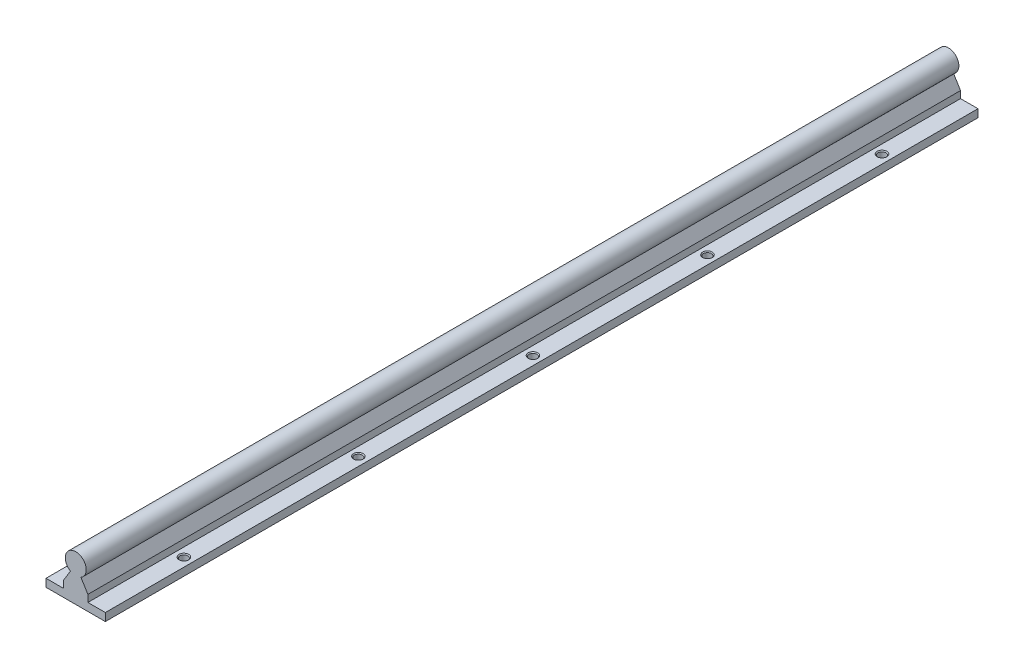
from build123d import *

# Parameters (mm, degrees)
EXTRUSION1_DEPTH                               = 500
FRAISAGE_POUR_VIS_T_TE_FRAIS_E_M41_D           = 4.5
FRAISAGE_POUR_VIS_T_TE_FRAIS_E_M41_CSINK_D     = 5.5
FRAISAGE_POUR_VIS_T_TE_FRAIS_E_M41_CSINK_ANGLE = 90


with BuildPart() as part:
    # Esquisse1 → Extrusion1 (new body)
    with BuildSketch(Plane.XY):
        with BuildLine():
            Line((-38.885451278, -19.821642953), (-4.885451278, -19.821642953))
            Line((-4.885451278, -19.821642953), (-4.885451278, -15.321642953))
            Line((-4.885451278, -15.321642953), (-14.885451278, -15.321642953))
            Line((-14.885451278, -15.321642953), (-14.885451278, -11.321642953))
            Line((-14.885451278, -11.321642953), (-18.885451278, -4.821642953))
            ThreePointArc((-18.885451278, -4.821642953), (-21.78726352, 6.400322803), (-24.885451278, -4.769021956))
            Line((-24.885451278, -4.769021956), (-28.885451278, -11.321642953))
            Line((-28.885451278, -11.321642953), (-28.885451278, -15.321642953))
            Line((-28.885451278, -15.321642953), (-38.885451278, -15.321642953))
            Line((-38.885451278, -15.321642953), (-38.885451278, -19.821642953))
        make_face()
    extrude(amount=EXTRUSION1_DEPTH)

    # Fraisage pour vis à tête fraisée M41 (through all)
    with Locations(Plane(origin=(-33.885451278, -15.321642953, 50), x_dir=(1, 0, 0), z_dir=(0, 1, 0))):
        with Locations((0, 0), (0, -100), (0, -200), (24, -200), (24, -100), (24, 0), (24, -300), (24, -400), (0, -300), (0, -400)):
            CounterSinkHole(FRAISAGE_POUR_VIS_T_TE_FRAIS_E_M41_D / 2, FRAISAGE_POUR_VIS_T_TE_FRAIS_E_M41_CSINK_D / 2, counter_sink_angle=FRAISAGE_POUR_VIS_T_TE_FRAIS_E_M41_CSINK_ANGLE)


solid = part.part
